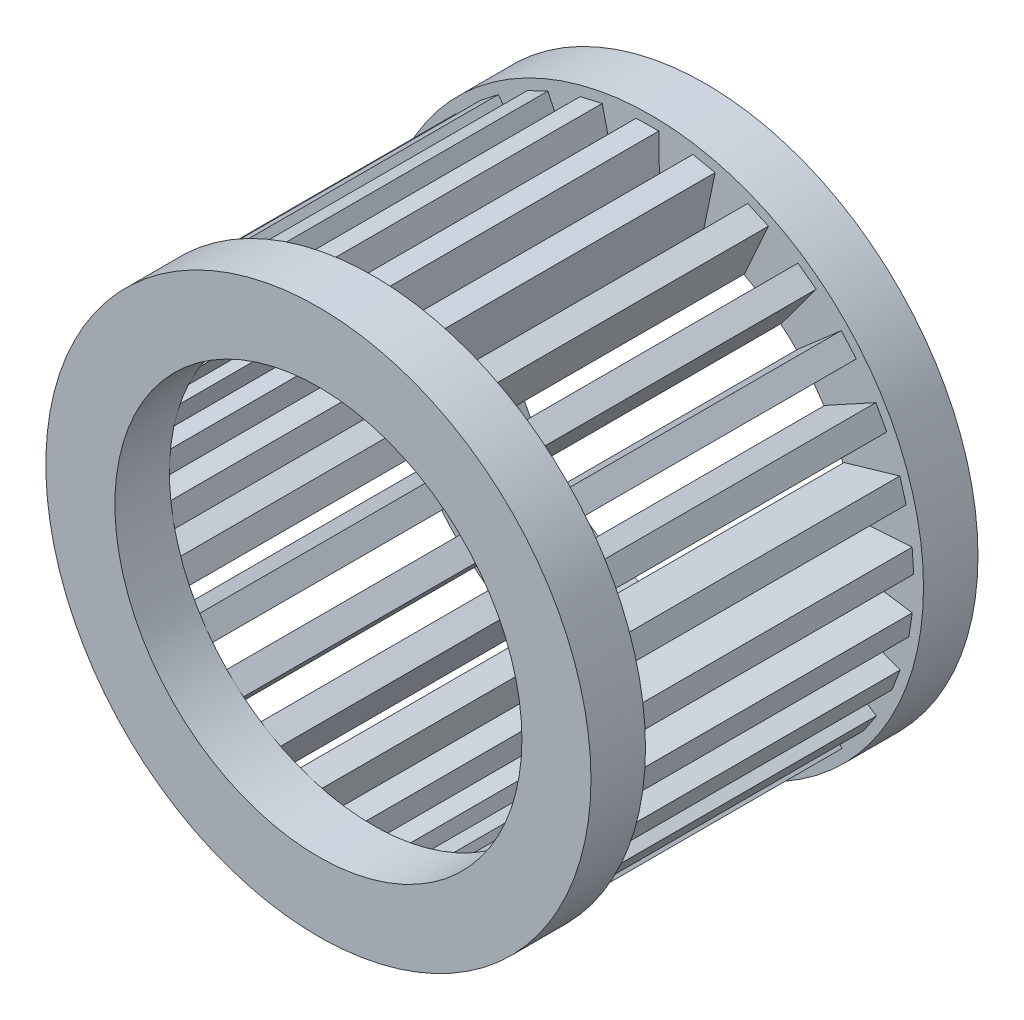
from build123d import *

# Parameters (mm, degrees)
BARS_START           = -15.4
BARS_DEPTH           = 30.8
BARS_2_DEPTH         = 30.8
BARS_3_DEPTH         = 30.8
BARS_4_DEPTH         = 30.8
BARS_5_DEPTH         = 30.8
BARS_6_DEPTH         = 30.8
BARS_7_DEPTH         = 30.8
BARS_8_DEPTH         = 30.8
BARS_9_DEPTH         = 30.8
BARS_10_DEPTH        = 30.8
BARS_11_DEPTH        = 30.8
BARS_12_DEPTH        = 30.8
BARS_13_DEPTH        = 30.8
BARS_14_DEPTH        = 30.8
BARS_15_DEPTH        = 30.8
BARS_16_DEPTH        = 30.8
BARS_17_DEPTH        = 30.8
BARS_18_DEPTH        = 30.8
BARS_19_DEPTH        = 30.8
BARS_20_DEPTH        = 30.8
BARS_21_DEPTH        = 30.8
BARS_22_DEPTH        = 30.8
BARS_23_DEPTH        = 30.8
BARS_24_DEPTH        = 30.8
BARS_25_DEPTH        = 30.8
BARS_26_DEPTH        = 30.8
BARS_27_DEPTH        = 30.8
BARS_28_DEPTH        = 30.8
BARS_29_DEPTH        = 30.8
END_RING_FRONT_START = 15.3
SKETCH_2_R           = 30
SKETCH_2_R_2         = 22.4
END_RING_FRONT_DEPTH = 6
END_RING_REAR_START  = -21.3
SKETCH_3_R           = 30
SKETCH_3_R_2         = 22.4
END_RING_REAR_DEPTH  = 6


with BuildPart() as part:
    # Эскиз1 → Bars (new body)
    with BuildSketch(Plane.XY.offset(BARS_START)):
        Polygon((22.533161901, 0.262896843), (28.918731651, 0.692430264), (28.750945159, 3.186793448), (22.365375408, 2.757260027), align=None)
    extrude(amount=BARS_DEPTH)



with BuildPart() as body_2:
    # Эскиз1 → Bars 2 (new body)
    with BuildSketch(Plane.XY.offset(BARS_START)):
        Polygon((21.949834048, 5.100714194), (28.093775737, 6.892914103), (27.393697648, 9.292891325), (21.249755958, 7.500691416), align=None)
    extrude(amount=BARS_2_DEPTH)


with BuildPart() as body_3:
    # Эскиз1 → Bars 3 (new body)
    with BuildSketch(Plane.XY.offset(BARS_START)):
        Polygon((20.34015635, 9.700027818), (25.955186093, 12.771092939), (24.755551281, 14.964463933), (19.140521537, 11.893398812), align=None)
    extrude(amount=BARS_3_DEPTH)


with BuildPart() as body_4:
    # Эскиз1 → Bars 4 (new body)
    with BuildSketch(Plane.XY.offset(BARS_START)):
        Polygon((17.779395547, 13.845778923), (22.602960795, 18.052109663), (20.959862849, 19.936314838), (16.136297602, 15.729984098), align=None)
    extrude(amount=BARS_4_DEPTH)


with BuildPart() as body_5:
    # Эскиз1 → Bars 5 (new body)
    with BuildSketch(Plane.XY.offset(BARS_START)):
        Polygon((14.387289969, 17.344116793), (18.193846171, 22.489029803), (16.184114527, 23.97596582), (12.377558325, 18.83105281), align=None)
    extrude(amount=BARS_5_DEPTH)


with BuildPart() as body_6:
    # Эскиз1 → Bars 6 (new body)
    with BuildSketch(Plane.XY.offset(BARS_START)):
        Polygon((10.322450703, 20.031463039), (12.934007522, 25.874387904), (10.651614996, 26.894527287), (8.040058177, 21.051602421), align=None)
    extrude(amount=BARS_6_DEPTH)


with BuildPart() as body_7:
    # Эскиз1 → Bars 7 (new body)
    with BuildSketch(Plane.XY.offset(BARS_START)):
        Polygon((5.774945114, 21.782160337), (7.069389055, 28.049888385), (4.621057787, 28.555530549), (3.326613846, 22.287802501), align=None)
    extrude(amount=BARS_7_DEPTH)


with BuildPart() as body_8:
    # Эскиз1 → Bars 8 (new body)
    with BuildSketch(Plane.XY.offset(BARS_START)):
        Polygon((0.95740951, 22.514348026), (0.874213814, 28.913807259), (-1.625574949, 28.88130894), (-1.542379252, 22.481849707), align=None)
    extrude(amount=BARS_8_DEPTH)


with BuildPart() as body_9:
    # Эскиз1 → Bars 9 (new body)
    with BuildSketch(Plane.XY.offset(BARS_START)):
        Polygon((-3.904893498, 22.193789824), (-5.361838694, 28.425748641), (-7.796197607, 27.856629424), (-6.339252411, 21.624670607), align=None)
    extrude(amount=BARS_9_DEPTH)


with BuildPart() as body_10:
    # Эскиз1 → Bars 10 (new body)
    with BuildSketch(Plane.XY.offset(BARS_START)):
        Polygon((-8.584608027, 20.835474677), (-11.347177584, 26.60853361), (-13.602278729, 25.529404877), (-10.839709172, 19.756345944), align=None)
    extrude(amount=BARS_10_DEPTH)


with BuildPart() as body_11:
    # Эскиз1 → Bars 11 (new body)
    with BuildSketch(Plane.XY.offset(BARS_START)):
        Polygon((-12.862915825, 18.502915891), (-16.801935061, 23.547133121), (-18.772332416, 22.008453732), (-14.83331318, 16.964236502), align=None)
    extrude(amount=BARS_11_DEPTH)


with BuildPart() as body_12:
    # Эскиз1 → Bars 12 (new body)
    with BuildSketch(Plane.XY.offset(BARS_START)):
        Polygon((-16.539767975, 15.305181323), (-21.471052729, 19.384694857), (-23.064612703, 17.45841175), (-18.13332795, 13.378898216), align=None)
    extrude(amount=BARS_12_DEPTH)


with BuildPart() as body_13:
    # Эскиз1 → Bars 13 (new body)
    with BuildSketch(Plane.XY.offset(BARS_START)):
        Polygon((-19.443238958, 11.391793486), (-25.136207835, 14.315849807), (-26.278417335, 12.092033839), (-20.585448458, 9.167977519), align=None)
    extrude(amount=BARS_13_DEPTH)


with BuildPart() as body_14:
    # Эскиз1 → Bars 14 (new body)
    with BuildSketch(Plane.XY.offset(BARS_START)):
        Polygon((-21.437565696, 6.945738047), (-27.626021799, 8.57761153), (-28.263472378, 6.160245865), (-22.075016276, 4.528372382), align=None)
    extrude(amount=BARS_14_DEPTH)


with BuildPart() as body_15:
    # Эскиз1 → Bars 15 (new body)
    with BuildSketch(Plane.XY.offset(BARS_START)):
        Polygon((-22.429495689, 2.174907617), (-28.824073688, 2.438293672), (-28.926958866, -0.059588359), (-22.532380867, -0.322974414), align=None)
    extrude(amount=BARS_15_DEPTH)


with BuildPart() as body_16:
    # Эскиз1 → Bars 16 (new body)
    with BuildSketch(Plane.XY.offset(BARS_START)):
        Polygon((-22.372647392, -2.697619077), (-28.674343927, -3.815036088), (-28.237852907, -6.276636298), (-21.936156372, -5.159219286), align=None)
    extrude(amount=BARS_16_DEPTH)


with BuildPart() as body_17:
    # Эскиз1 → Bars 17 (new body)
    with BuildSketch(Plane.XY.offset(BARS_START)):
        Polygon((-21.269678968, -7.4440081), (-27.183833713, -9.889979002), (-26.22837633, -12.200195699), (-20.314221585, -9.754224798), align=None)
    extrude(amount=BARS_17_DEPTH)


with BuildPart() as body_18:
    # Эскиз1 → Bars 18 (new body)
    with BuildSketch(Plane.XY.offset(BARS_START)):
        Polygon((-19.172163995, -11.842323579), (-24.422237648, -15.502477488), (-22.992490027, -17.553287509), (-17.742416374, -13.893133599), align=None)
    extrude(amount=BARS_18_DEPTH)


with BuildPart() as body_19:
    # Эскиз1 → Bars 19 (new body)
    with BuildSketch(Plane.XY.offset(BARS_START)):
        Polygon((-16.178179942, -15.686905168), (-20.518684893, -20.390097358), (-18.681500444, -22.085607104), (-14.340995493, -17.382414915), align=None)
    extrude(amount=BARS_19_DEPTH)


with BuildPart() as body_20:
    # Эскиз1 → Bars 20 (new body)
    with BuildSketch(Plane.XY.offset(BARS_START)):
        Polygon((-12.427722176, -18.797984507), (-15.655701238, -24.324298936), (-13.496984664, -25.585228257), (-10.269005602, -20.058913828), align=None)
    extrude(amount=BARS_20_DEPTH)


with BuildPart() as body_21:
    # Эскиз1 → Bars 21 (new body)
    with BuildSketch(Plane.XY.offset(BARS_START)):
        Polygon((-8.096157933, -21.030090982), (-10.060674393, -27.121123332), (-7.681364881, -27.888512573), (-5.716848422, -21.797480224), align=None)
    extrude(amount=BARS_21_DEPTH)


with BuildPart() as body_22:
    # Эскиз1 → Bars 22 (new body)
    with BuildSketch(Plane.XY.offset(BARS_START)):
        Polygon((-3.386026344, -22.278853777), (-3.995221595, -28.649794143), (-1.506573014, -28.887761037), (-0.897377763, -22.516820671), align=None)
    extrude(amount=BARS_22_DEPTH)


with BuildPart() as body_23:
    # Эскиз1 → Bars 23 (new body)
    with BuildSketch(Plane.XY.offset(BARS_START)):
        Polygon((1.482432074, -22.48588213), (2.257043325, -28.838832421), (4.738664533, -28.536249902), (3.964053282, -22.18329961), align=None)
    extrude(amount=BARS_23_DEPTH)


with BuildPart() as body_24:
    # Эскиз1 → Bars 24 (new body)
    with BuildSketch(Plane.XY.offset(BARS_START)):
        Polygon((6.281573616, -21.641495625), (8.403771407, -27.679398948), (10.762327392, -26.850415436), (8.640129601, -20.812512113), align=None)
    extrude(amount=BARS_24_DEPTH)


with BuildPart() as body_25:
    # Эскиз1 → Bars 25 (new body)
    with BuildSketch(Plane.XY.offset(BARS_START)):
        Polygon((10.786995757, -19.785176839), (14.157548478, -25.225707544), (16.282755785, -23.909085387), (12.912203064, -18.468554682), align=None)
    extrude(amount=BARS_25_DEPTH)


with BuildPart() as body_26:
    # Эскиз1 → Bars 26 (new body)
    with BuildSketch(Plane.XY.offset(BARS_START)):
        Polygon((14.788029965, -17.003725173), (19.249334318, -21.592490091), (21.041820614, -19.849793078), (16.580516262, -15.26102816), align=None)
    extrude(amount=BARS_26_DEPTH)


with BuildPart() as body_27:
    # Эскиз1 → Bars 27 (new body)
    with BuildSketch(Plane.XY.offset(BARS_START)):
        Polygon((18.097592328, -13.427198216), (23.441042678, -16.9496318), (24.816993297, -14.862346507), (19.473542947, -11.339912923), align=None)
    extrude(amount=BARS_27_DEPTH)


with BuildPart() as body_28:
    # Эскиз1 → Bars 28 (new body)
    with BuildSketch(Plane.XY.offset(BARS_START)):
        Polygon((20.560931388, -9.222830393), (26.536673936, -11.514227564), (27.431750956, -9.179953131), (21.456008407, -6.88855596), align=None)
    extrude(amount=BARS_28_DEPTH)


with BuildPart() as body_29:
    # Эскиз1 → Bars 29 (new body)
    with BuildSketch(Plane.XY.offset(BARS_START)):
        Polygon((22.062864148, -4.587213273), (28.391479815, -5.540430844), (28.763830428, -3.068315349), (22.435214761, -2.115097778), align=None)
    extrude(amount=BARS_29_DEPTH)


with BuildPart() as part_1:
    add(part.part)

    add(body_2.part)  # End_ring_front merges body 2

    add(body_3.part)  # End_ring_front merges body 3

    add(body_4.part)  # End_ring_front merges body 4

    add(body_5.part)  # End_ring_front merges body 5

    add(body_6.part)  # End_ring_front merges body 6

    add(body_7.part)  # End_ring_front merges body 7

    add(body_8.part)  # End_ring_front merges body 8

    add(body_9.part)  # End_ring_front merges body 9

    add(body_10.part)  # End_ring_front merges body 10

    add(body_11.part)  # End_ring_front merges body 11

    add(body_12.part)  # End_ring_front merges body 12

    add(body_13.part)  # End_ring_front merges body 13

    add(body_14.part)  # End_ring_front merges body 14

    add(body_15.part)  # End_ring_front merges body 15

    add(body_16.part)  # End_ring_front merges body 16

    add(body_17.part)  # End_ring_front merges body 17

    add(body_18.part)  # End_ring_front merges body 18

    add(body_19.part)  # End_ring_front merges body 19

    add(body_20.part)  # End_ring_front merges body 20

    add(body_21.part)  # End_ring_front merges body 21

    add(body_22.part)  # End_ring_front merges body 22

    add(body_23.part)  # End_ring_front merges body 23

    add(body_24.part)  # End_ring_front merges body 24

    add(body_25.part)  # End_ring_front merges body 25

    add(body_26.part)  # End_ring_front merges body 26

    add(body_27.part)  # End_ring_front merges body 27

    add(body_28.part)  # End_ring_front merges body 28

    add(body_29.part)  # End_ring_front merges body 29
    # Эскиз2 → End_ring_front (add)
    with BuildSketch(Plane.XY.offset(END_RING_FRONT_START)):
        Circle(SKETCH_2_R)
        Circle(SKETCH_2_R_2, mode=Mode.SUBTRACT)
    extrude(amount=END_RING_FRONT_DEPTH)

    # Эскиз3 → End_ring_rear (add)
    with BuildSketch(Plane.XY.offset(END_RING_REAR_START)):
        Circle(SKETCH_3_R)
        Circle(SKETCH_3_R_2, mode=Mode.SUBTRACT)
    extrude(amount=END_RING_REAR_DEPTH)


solid = part_1.part
